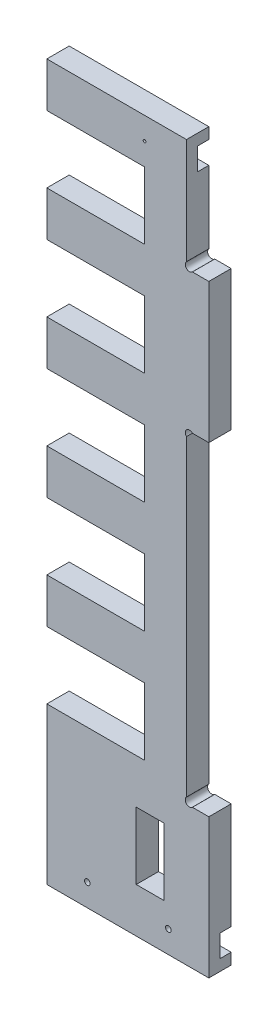
from build123d import *

# Parameters (mm, degrees)
ESQUISSE1_W             = 10
ESQUISSE1_H             = 24
BOSS_EXTRU_1_DEPTH      = 8
ESQUISSE2_W             = 51.367722688
ESQUISSE2_H             = 8
ESQUISSE2_W_2           = 58
ESQUISSE2_H_2           = 7.931606273
ENL_V_MAT_EXTRU_1_DEPTH = 4
ESQUISSE3_R             = 0.5
ESQUISSE3_R_2           = 1
ENL_V_MAT_EXTRU_2_DEPTH = 4


with BuildPart() as part:
    # Esquisse1 → Boss.-Extru.1 (new body)
    with BuildSketch(Plane.XY):
        with BuildLine():
            Line((30.577007139, 186.135890651), (30.577007139, 224.014570308))
            Line((30.577007139, 224.014570308), (-19.422992861, 224.014570308))
            Line((-19.422992861, 224.014570308), (-19.422992861, 208.014570308))
            Line((-19.422992861, 208.014570308), (15.577007139, 208.014570308))
            Line((15.577007139, 208.014570308), (15.577007139, 184.014570308))
            Line((15.577007139, 184.014570308), (-19.422992861, 184.014570308))
            Line((-19.422992861, 184.014570308), (-19.422992861, 168.014570308))
            Line((-19.422992861, 168.014570308), (15.577007139, 168.014570308))
            Line((15.577007139, 168.014570308), (15.577007139, 144.014570308))
            Line((15.577007139, 144.014570308), (-19.422992861, 144.014570308))
            Line((-19.422992861, 144.014570308), (-19.422992861, 128.014570308))
            Line((-19.422992861, 128.014570308), (15.577007139, 128.014570308))
            Line((15.577007139, 128.014570308), (15.577007139, 104.014570308))
            Line((15.577007139, 104.014570308), (-19.422992861, 104.014570308))
            Line((-19.422992861, 104.014570308), (-19.422992861, 88.014570308))
            Line((-19.422992861, 88.014570308), (15.577007139, 88.014570308))
            Line((15.577007139, 88.014570308), (15.577007139, 64.014570308))
            Line((15.577007139, 64.014570308), (-19.422992861, 64.014570308))
            Line((-19.422992861, 64.014570308), (-19.422992861, 48.014570308))
            Line((-19.422992861, 48.014570308), (15.577007139, 48.014570308))
            Line((15.577007139, 48.014570308), (15.577007139, 24.014570308))
            Line((15.577007139, 24.014570308), (-19.422992861, 24.014570308))
            Line((-19.422992861, 24.014570308), (-19.422992861, -31.985429692))
            Line((-19.422992861, -31.985429692), (30.577007139, -31.985429692))
            Line((30.577007139, -31.985429692), (38.577007139, -31.985429692))
            Line((38.577007139, -31.985429692), (38.577007139, 18.014570308))
            Line((38.577007139, 18.014570308), (32.698327483, 18.014570308))
            ThreePointArc((32.698327483, 18.014570308), (30.577007139, 18.014570308), (30.577007139, 20.135890651))
            Line((30.577007139, 20.135890651), (30.577007139, 131.893249964))
            ThreePointArc((30.577007139, 131.893249964), (30.577007139, 134.014570308), (32.698327483, 134.014570308))
            Line((32.698327483, 134.014570308), (38.577007139, 134.014570308))
            Line((38.577007139, 134.014570308), (38.577007139, 184.014570308))
            Line((38.577007139, 184.014570308), (32.698327483, 184.014570308))
            ThreePointArc((32.698327483, 184.014570308), (30.577007139, 184.014570308), (30.577007139, 186.135890651))
        make_face()
        with Locations((17.577007139, -3.985429692)):
            Rectangle(ESQUISSE1_W, ESQUISSE1_H, mode=Mode.SUBTRACT)
    extrude(amount=BOSS_EXTRU_1_DEPTH)

    # Esquisse2 → Enlèv. mat.-Extru.1 (cut)
    with BuildSketch(Plane(origin=(0, 0, 0), x_dir=(-1, 0, 0), z_dir=(0, 0, -1))):
        with BuildLine():
            Line((19.422992861, 172.014570308), (-28.510535818, 172.014570308))
            ThreePointArc((-28.510535818, 172.014570308), (-30.446580511, 172.195764547), (-30.577007139, 174.135890651))
            Line((-30.577007139, 174.135890651), (-30.577007139, 177.893249964))
            ThreePointArc((-30.577007139, 177.893249964), (-30.446580511, 179.833376068), (-28.510535818, 180.014570308))
            Line((-28.510535818, 180.014570308), (19.422992861, 180.014570308))
            Line((19.422992861, 180.014570308), (19.422992861, 172.014570308))
        make_face()
        with BuildLine():
            Line((19.422992861, 140.014570308), (-18.455686796, 140.014570308))
            ThreePointArc((-18.455686796, 140.014570308), (-20.577007139, 140.014570308), (-20.577007139, 137.893249964))
            Line((-20.577007139, 137.893249964), (-20.577007139, 134.135890651))
            ThreePointArc((-20.577007139, 134.135890651), (-20.577007139, 132.014570308), (-18.455686796, 132.014570308))
            Line((-18.455686796, 132.014570308), (19.422992861, 132.014570308))
            Line((19.422992861, 132.014570308), (19.422992861, 140.014570308))
        make_face()
        with BuildLine():
            Line((19.422992861, 100.014570308), (-18.455686796, 100.014570308))
            ThreePointArc((-18.455686796, 100.014570308), (-20.577007139, 100.014570308), (-20.577007139, 97.893249964))
            Line((-20.577007139, 97.893249964), (-20.577007139, 94.135890651))
            ThreePointArc((-20.577007139, 94.135890651), (-20.577007139, 92.014570308), (-18.455686796, 92.014570308))
            Line((-18.455686796, 92.014570308), (19.422992861, 92.014570308))
            Line((19.422992861, 92.014570308), (19.422992861, 100.014570308))
        make_face()
        with BuildLine():
            Line((19.422992861, 60.014570308), (-18.455686796, 60.014570308))
            ThreePointArc((-18.455686796, 60.014570308), (-20.577007139, 60.014570308), (-20.577007139, 57.893249964))
            Line((-20.577007139, 57.893249964), (-20.577007139, 54.135890651))
            ThreePointArc((-20.577007139, 54.135890651), (-20.577007139, 52.014570308), (-18.455686796, 52.014570308))
            Line((-18.455686796, 52.014570308), (19.422992861, 52.014570308))
            Line((19.422992861, 52.014570308), (19.422992861, 60.014570308))
        make_face()
        with BuildLine():
            Line((19.422992861, 20.014570308), (-18.455686796, 20.014570308))
            ThreePointArc((-18.455686796, 20.014570308), (-20.577007139, 20.014570308), (-20.577007139, 17.893249964))
            Line((-20.577007139, 17.893249964), (-20.577007139, 14.135890651))
            ThreePointArc((-20.577007139, 14.135890651), (-20.577007139, 12.014570308), (-18.455686796, 12.014570308))
            Line((-18.455686796, 12.014570308), (19.422992861, 12.014570308))
            Line((19.422992861, 12.014570308), (19.422992861, 20.014570308))
        make_face()
        with Locations((-6.260868483, 216.014570308)):
            Rectangle(ESQUISSE2_W, ESQUISSE2_H)
        with Locations((-9.577007139, -24.019626556)):
            Rectangle(ESQUISSE2_W_2, ESQUISSE2_H_2)
    extrude(amount=-ENL_V_MAT_EXTRU_1_DEPTH, mode=Mode.SUBTRACT)

    # Esquisse3 → Enlèv. mat.-Extru.2 (cut)
    with BuildSketch(Plane(origin=(0, 0, 4), x_dir=(-1, 0, 0), z_dir=(0, 0, -1))):
        with Locations((-15.577007139, 216.014570308)):
            Circle(ESQUISSE3_R)
        with Locations((4.922992861, -24.019626556)):
            Circle(ESQUISSE3_R_2)
        with Locations(Location((-24.077007139, -24.019626556, 0), (0, 0, 180))):
            Circle(ESQUISSE3_R_2)
    extrude(amount=-ENL_V_MAT_EXTRU_2_DEPTH, mode=Mode.SUBTRACT)


solid = part.part
